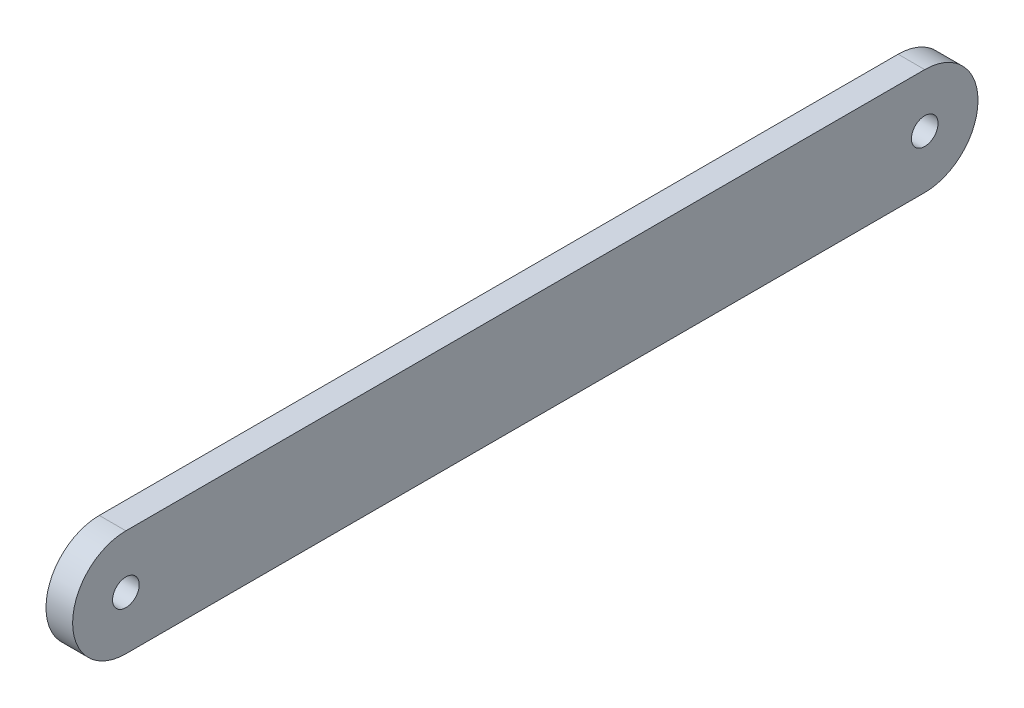
from build123d import *

# Parameters (mm, degrees)
SKETCH1_R           = 2.5
BOSS_EXTRUDE1_DEPTH = 5


with BuildPart() as part:
    # Sketch1 → Boss-Extrude1 (new body)
    with BuildSketch(Plane(origin=(0, 0, 0), x_dir=(0, 0, -1), z_dir=(1, 0, 0))):
        with BuildLine():
            Line((0, 10), (150, 10))
            ThreePointArc((150, 10), (160, 0), (150, -10))
            Line((150, -10), (0, -10))
            ThreePointArc((0, -10), (-10, 0), (0, 10))
        make_face()
        Circle(SKETCH1_R, mode=Mode.SUBTRACT)
        with Locations((150, 0)):
            Circle(SKETCH1_R, mode=Mode.SUBTRACT)
    extrude(amount=BOSS_EXTRUDE1_DEPTH)


solid = part.part
